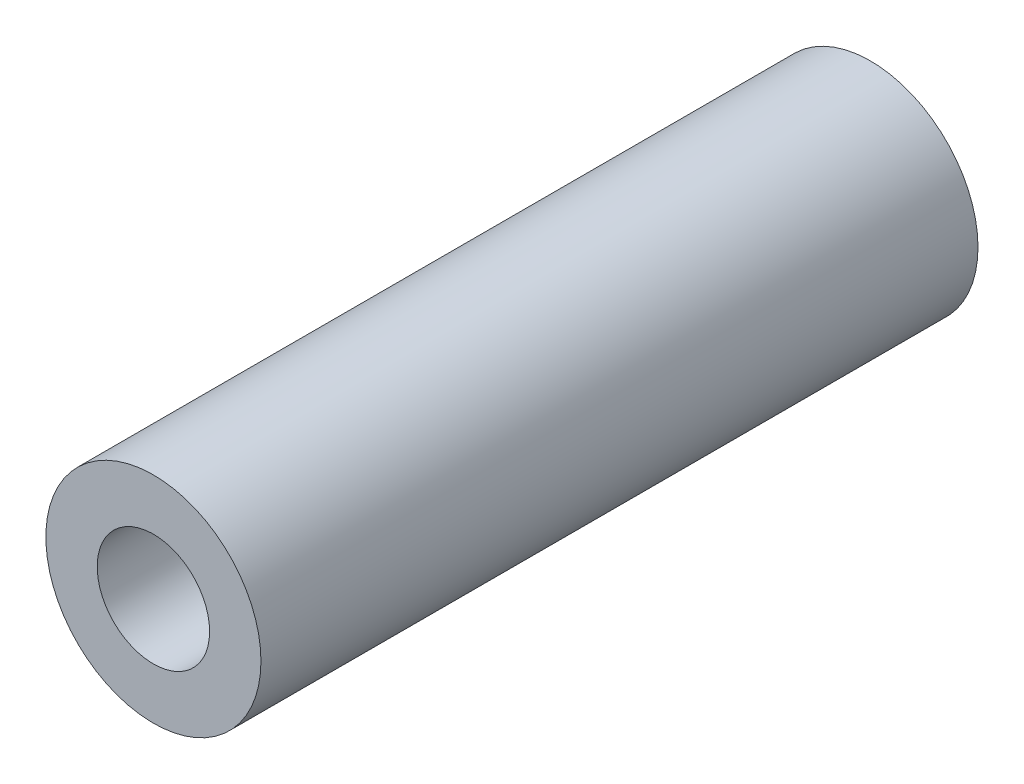
from build123d import *

# Parameters (mm, degrees)
SKETCH1_R           = 4.7625
SKETCH1_R_2         = 2.4892
BOSS_EXTRUDE1_DEPTH = 15.875


with BuildPart() as part:
    # Sketch1 → Boss-Extrude1 (new, symmetric)
    with BuildSketch(Plane.XY):
        Circle(SKETCH1_R)
        Circle(SKETCH1_R_2, mode=Mode.SUBTRACT)
    extrude(amount=BOSS_EXTRUDE1_DEPTH, both=True)


solid = part.part
